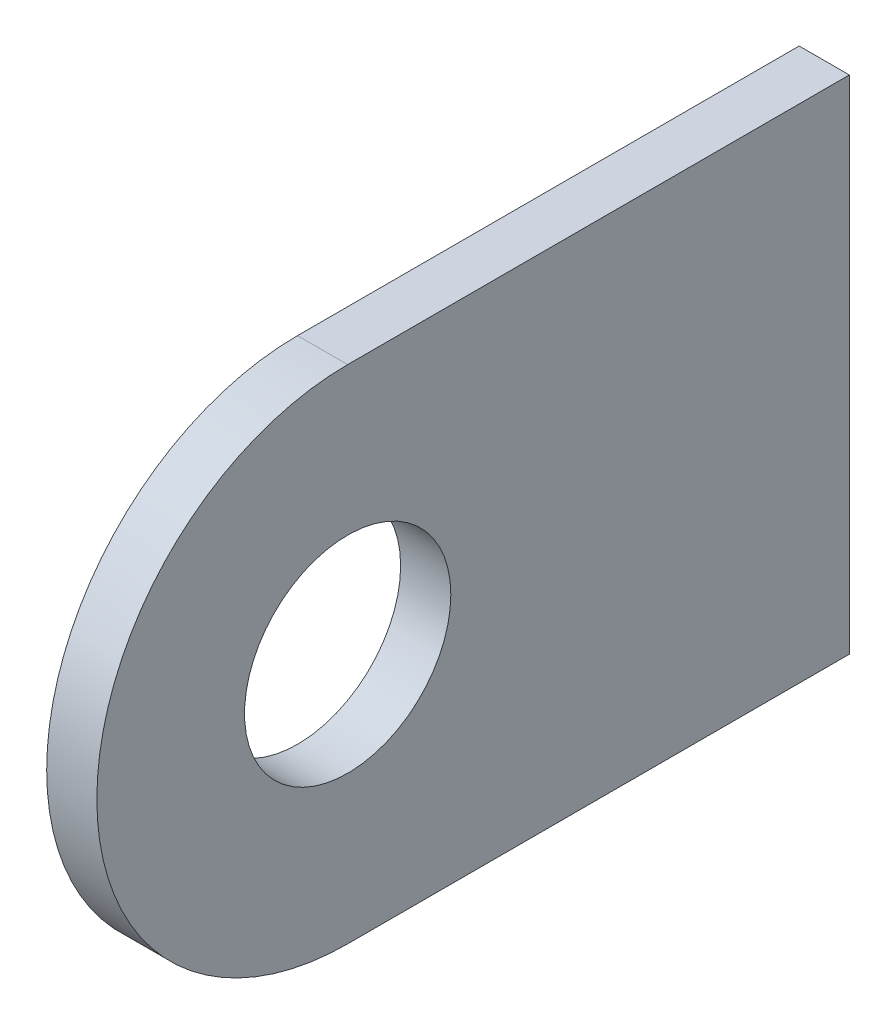
from build123d import *

# Parameters (mm, degrees)
BOSS_EXTRUDE1_DEPTH     = 1.5875
F_1_4_CLEARANCE_HOLE1_D = 6.5278


with BuildPart() as part:
    # Sketch1 → Boss-Extrude1 (new body)
    with BuildSketch(Plane(origin=(0, 0, 0), x_dir=(0, 0, -1), z_dir=(1, 0, 0))):
        with BuildLine():
            Line((0, -7.9375), (0, 7.9375))
            Line((0, 7.9375), (-15.875, 7.9375))
            ThreePointArc((-15.875, 7.9375), (-23.8125, 0), (-15.875, -7.9375))
            Line((-15.875, -7.9375), (0, -7.9375))
        make_face()
    extrude(amount=BOSS_EXTRUDE1_DEPTH)

    # 1/4 Clearance Hole1 (through all)
    with Locations(Plane(origin=(1.5875, 0, 0), x_dir=(0, 0, -1), z_dir=(1, 0, 0))):
        with Locations((-15.875, 0)):
            Hole(F_1_4_CLEARANCE_HOLE1_D / 2)


solid = part.part
